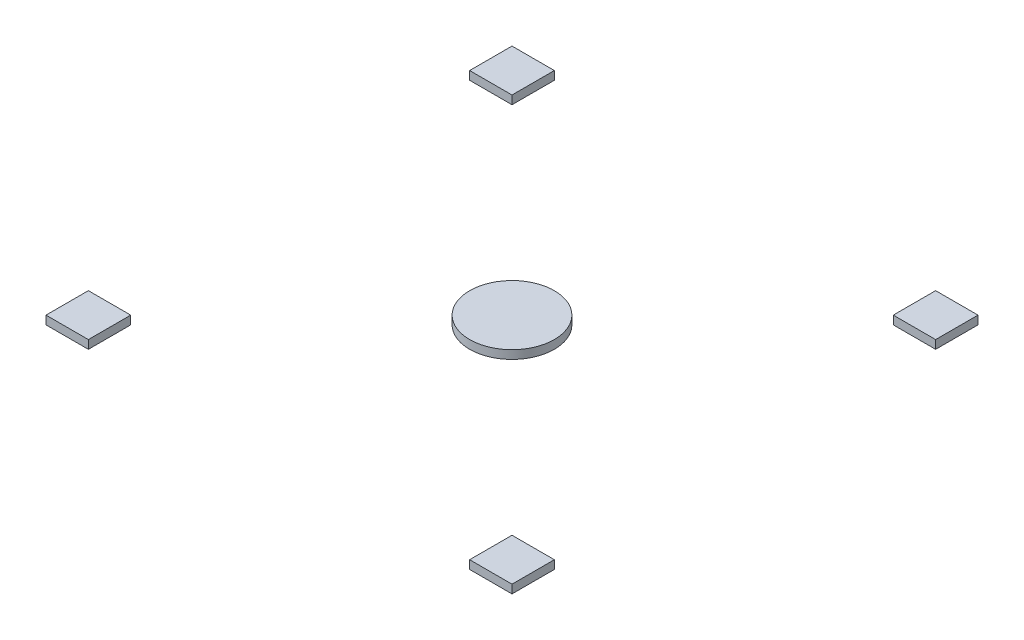
from build123d import *

# Parameters (mm, degrees)
SKIZZE1_R                         = 10
AUFSATZ_LINEAR_AUSTRAGEN1_DEPTH   = 2
SKIZZE1_W                         = 10
SKIZZE1_H                         = 10
AUFSATZ_LINEAR_AUSTRAGEN1_2_DEPTH = 2
AUFSATZ_LINEAR_AUSTRAGEN1_3_DEPTH = 2
AUFSATZ_LINEAR_AUSTRAGEN1_4_DEPTH = 2
AUFSATZ_LINEAR_AUSTRAGEN1_5_DEPTH = 2


with BuildPart() as part:
    # Skizze1 → Aufsatz-Linear austragen1 (new body)
    with BuildSketch(Plane(origin=(0, 0, 0), x_dir=(1, 0, 0), z_dir=(0, 1, 0))):
        with Locations(Location((0, 0, 0), (0, 0, 270))):
            Circle(SKIZZE1_R)
    extrude(amount=AUFSATZ_LINEAR_AUSTRAGEN1_DEPTH)


with BuildPart() as body_2:
    # Skizze1 → Aufsatz-Linear austragen1 2 (new body)
    with BuildSketch(Plane(origin=(0, 0, 0), x_dir=(1, 0, 0), z_dir=(0, 1, 0))):
        with Locations((50, 50)):
            Rectangle(SKIZZE1_W, SKIZZE1_H)
    extrude(amount=AUFSATZ_LINEAR_AUSTRAGEN1_2_DEPTH)


with BuildPart() as body_3:
    # Skizze1 → Aufsatz-Linear austragen1 3 (new body)
    with BuildSketch(Plane(origin=(0, 0, 0), x_dir=(1, 0, 0), z_dir=(0, 1, 0))):
        with Locations((-50, 50)):
            Rectangle(SKIZZE1_W, SKIZZE1_H)
    extrude(amount=AUFSATZ_LINEAR_AUSTRAGEN1_3_DEPTH)


with BuildPart() as body_4:
    # Skizze1 → Aufsatz-Linear austragen1 4 (new body)
    with BuildSketch(Plane(origin=(0, 0, 0), x_dir=(1, 0, 0), z_dir=(0, 1, 0))):
        with Locations((50, -50)):
            Rectangle(SKIZZE1_W, SKIZZE1_H)
    extrude(amount=AUFSATZ_LINEAR_AUSTRAGEN1_4_DEPTH)


with BuildPart() as body_5:
    # Skizze1 → Aufsatz-Linear austragen1 5 (new body)
    with BuildSketch(Plane(origin=(0, 0, 0), x_dir=(1, 0, 0), z_dir=(0, 1, 0))):
        with Locations((-50, -50)):
            Rectangle(SKIZZE1_W, SKIZZE1_H)
    extrude(amount=AUFSATZ_LINEAR_AUSTRAGEN1_5_DEPTH)


solid = Compound([part.part, body_2.part, body_3.part, body_4.part, body_5.part])
